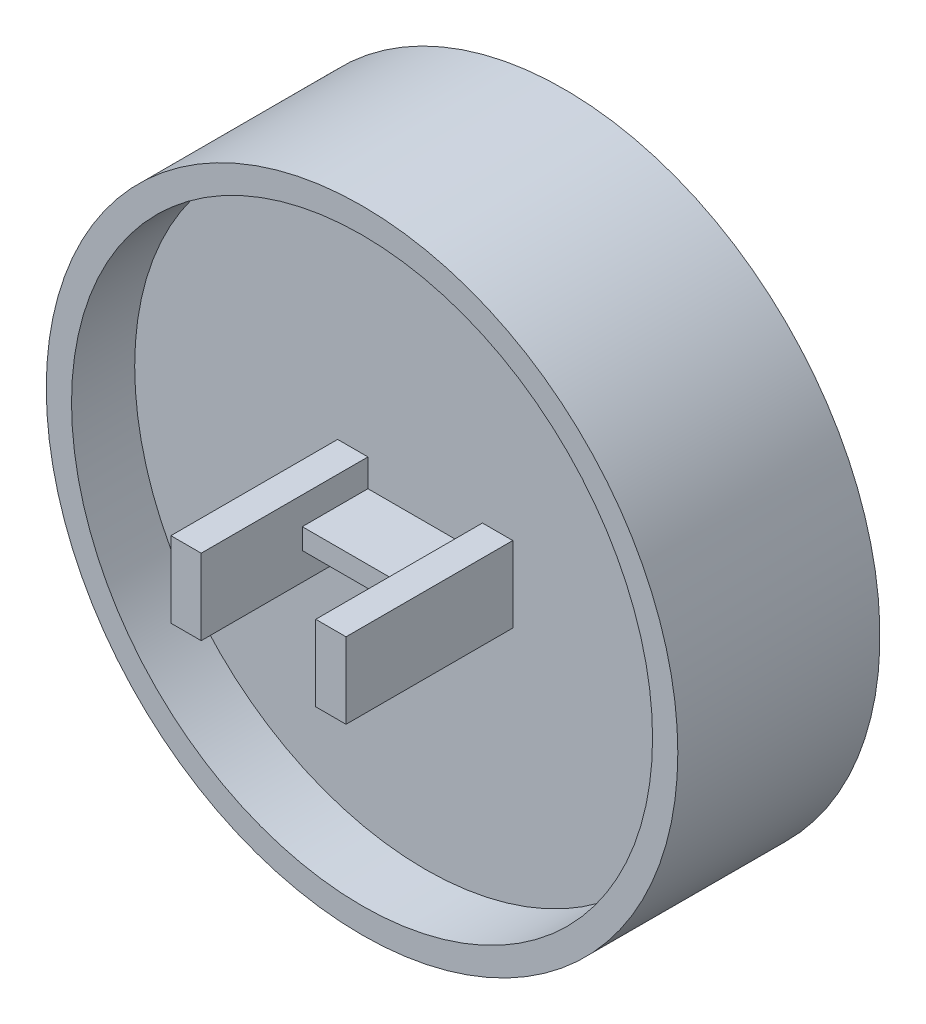
from build123d import *

# Parameters (mm, degrees)
SKETCH1_R           = 12.5
BOSS_EXTRUDE1_DEPTH = 5
SKETCH2_R           = 11.5
CUT_EXTRUDE1_DEPTH  = 2.5
BOSS_EXTRUDE2_DEPTH = 2.6
SKETCH4_W           = 1.2
SKETCH4_H           = 3
BOSS_EXTRUDE3_DEPTH = 4
BOSS_EXTRUDE4_START = 3
SKETCH5_R           = 12.5
BOSS_EXTRUDE4_DEPTH = 3


with BuildPart() as part:
    # Sketch1 → Boss-Extrude1 (new body)
    with BuildSketch(Plane.XY):
        Circle(SKETCH1_R)
    extrude(amount=BOSS_EXTRUDE1_DEPTH)

    # Sketch2 → Cut-Extrude1 (cut)
    with BuildSketch(Plane.XY.offset(5)):
        Circle(SKETCH2_R)
    extrude(amount=-CUT_EXTRUDE1_DEPTH, mode=Mode.SUBTRACT)

    # Sketch3 → Boss-Extrude2 (add)
    with BuildSketch(Plane.XY.offset(2.5)):
        Polygon((-2.2665, 0.415113025), (2.2665, 0.415113025), (2.2665, 1.506034439), (3.4665, 1.506034439), (3.4665, -1.493965561), (2.2665, -1.493965561), (2.2665, -0.403044147), (-2.2665, -0.403044147), (-2.2665, -1.493965561), (-3.4665, -1.493965561), (-3.4665, 1.506034439), (-2.2665, 1.506034439), align=None)
    extrude(amount=BOSS_EXTRUDE2_DEPTH)

    # Sketch4 → Boss-Extrude3 (add)
    with BuildSketch(Plane.XY.offset(5.1)):
        with Locations((-2.8665, 0.006034439)):
            Rectangle(SKETCH4_W, SKETCH4_H)
        with Locations((2.8665, 0.006034439)):
            Rectangle(SKETCH4_W, SKETCH4_H)
    extrude(amount=BOSS_EXTRUDE3_DEPTH)

    # Sketch5 → Boss-Extrude4 (add)
    with BuildSketch(Plane(origin=(0, 0, 0), x_dir=(-1, 0, 0), z_dir=(0, 0, -1)).offset(BOSS_EXTRUDE4_START)):
        Circle(SKETCH5_R)
    extrude(amount=-BOSS_EXTRUDE4_DEPTH)


solid = part.part
